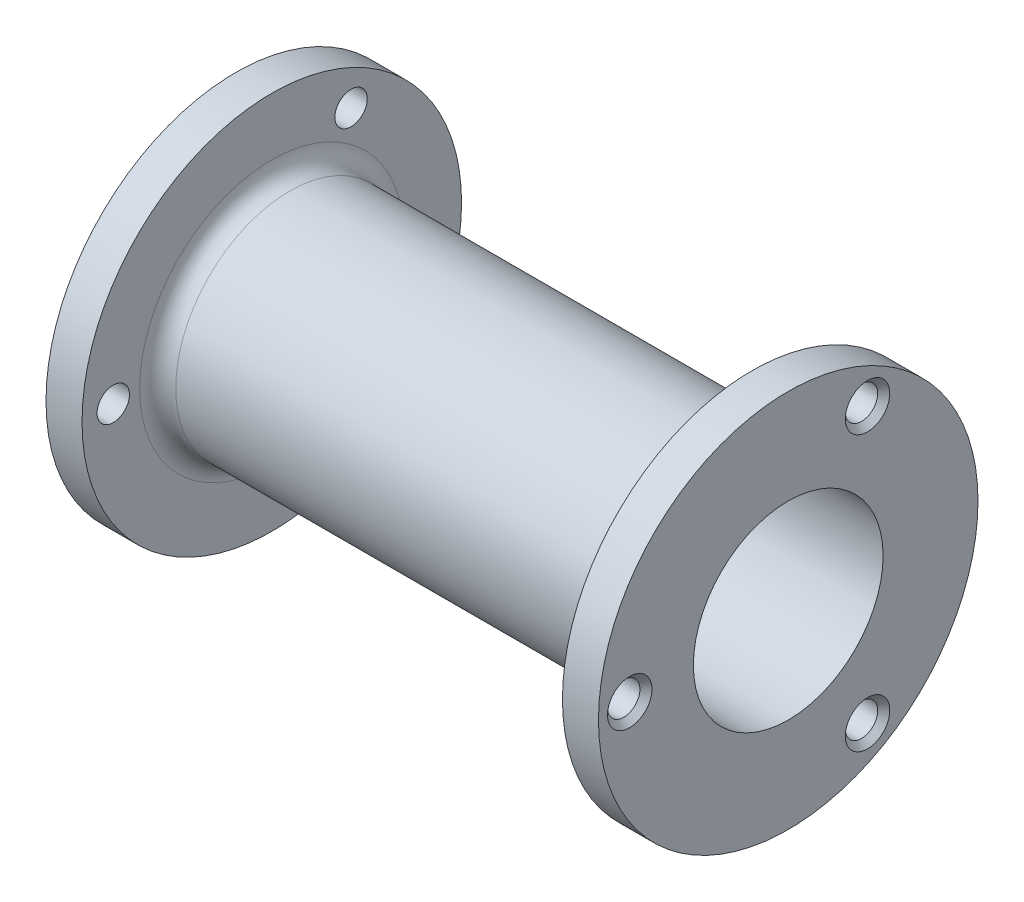
from build123d import *

# Parameters (mm, degrees)
SKETCH3_R          = 1.35
CUT_EXTRUDE1_DEPTH = 52.139808369
CHAMFER1_SIZE      = 0.5


with BuildPart() as part:
    # Sketch1 → Revolve1 (revolve)
    with BuildSketch(Plane.XY, mode=Mode.PRIVATE) as revolve1_sk:
        with BuildLine():
            Line((0, 7.9), (0, 15.8))
            Line((0, 15.8), (3, 15.8))
            Line((3, 15.8), (3, 11))
            ThreePointArc((3, 11), (3.439339828, 9.939339828), (4.5, 9.5))
            Line((4.5, 9.5), (41.5, 9.5))
            ThreePointArc((41.5, 9.5), (42.560660172, 9.939339828), (43, 11))
            Line((43, 11), (43, 15.8))
            Line((43, 15.8), (46, 15.8))
            Line((46, 15.8), (46, 7.9))
            Line((46, 7.9), (43, 7.9))
            Line((43, 7.9), (3, 7.9))
            Line((3, 7.9), (0, 7.9))
        make_face()
    revolve(revolve1_sk.sketch.rotate(Axis((0, 0, 0), (-1, 0, 0)), 90), axis=Axis((0, 0, 0), (-1, 0, 0)))

    # Sketch3 → Cut-Extrude1 (cut, through all)
    with BuildSketch(Plane(origin=(46, 0, 0), x_dir=(0, 0, -1), z_dir=(1, 0, 0))):
        with Locations((-13.2, 0)):
            Circle(SKETCH3_R)
        with Locations((6.6, 11.43153533)):
            Circle(SKETCH3_R)
        with Locations((6.6, -11.43153533)):
            Circle(SKETCH3_R)
    extrude(amount=-CUT_EXTRUDE1_DEPTH, mode=Mode.SUBTRACT)

    # Chamfer1
    chamfer1_edges = [part.edges().sort_by_distance(p)[0] for p in [
        (0, 0, 14.55),
        (46, 0, 14.55),
        (0, 11.43153533, -5.25),
        (46, 11.43153533, -5.25),
        (0, -11.43153533, -5.25),
        (46, -11.43153533, -5.25),
    ]]
    chamfer(chamfer1_edges, length=CHAMFER1_SIZE)


solid = part.part
